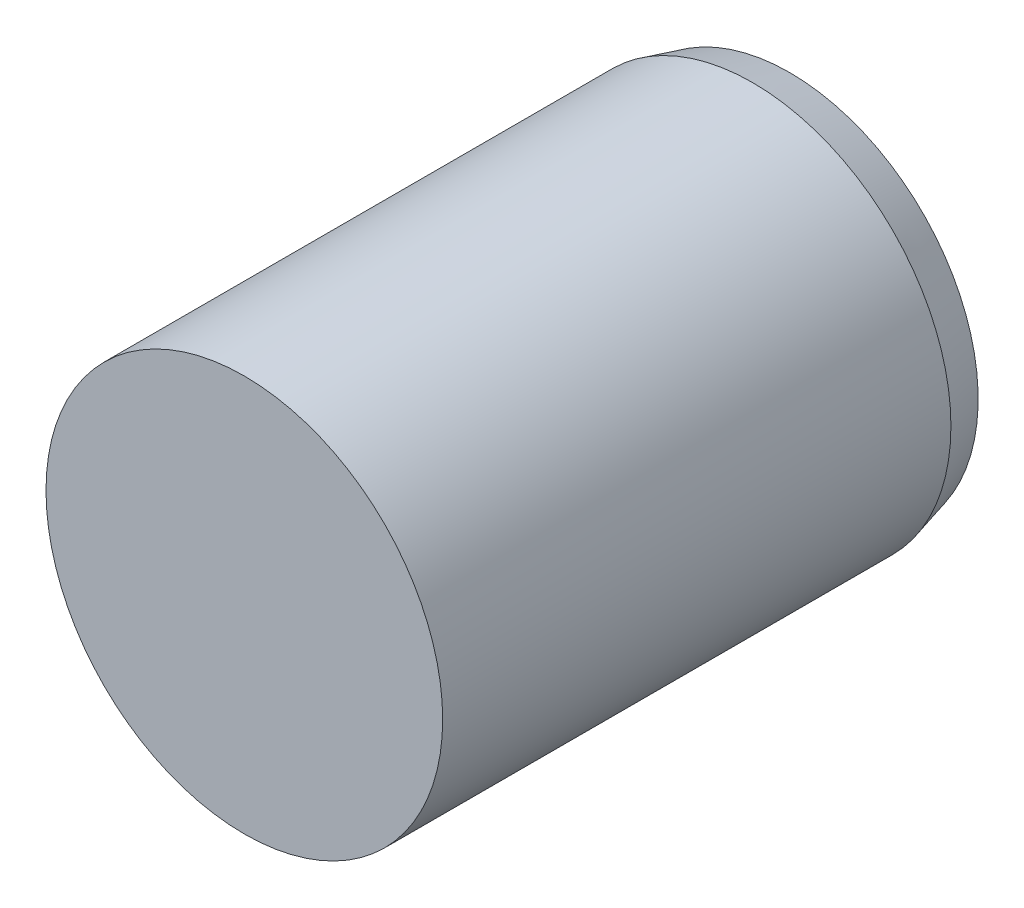
from build123d import *

# Parameters (mm, degrees)
CUT_EXTRUDE1_START = -3.96875
SKETCH4_R          = 3.175
CUT_EXTRUDE1_DEPTH = 3.96875


with BuildPart() as part:
    # Sketch3 → Revolve1 (revolve)
    with BuildSketch(Plane(origin=(0, 0, 0), x_dir=(0, 0, -1), z_dir=(1, 0, 0)), mode=Mode.PRIVATE) as revolve1_sk:
        Polygon((-6.35, 2.38125), (-5.55625, 3.175), (5.7546875, 3.175), (6.35, 3.015486496), (6.35, 0), (-6.35, 0), align=None)
    revolve(revolve1_sk.sketch.rotate(Axis((0, 0, 6.35), (0, 0, -1)), 180), axis=Axis((0, 0, 6.35), (0, 0, -1)))

    # Sketch4 → Cut-Extrude1 (cut)
    with BuildSketch(Plane.XY.offset(6.35).offset(CUT_EXTRUDE1_START)):
        with Locations(Location((0, 0, 0), (0, 0, 270))):
            Circle(SKETCH4_R)
    extrude(amount=CUT_EXTRUDE1_DEPTH, mode=Mode.SUBTRACT)


solid = part.part
